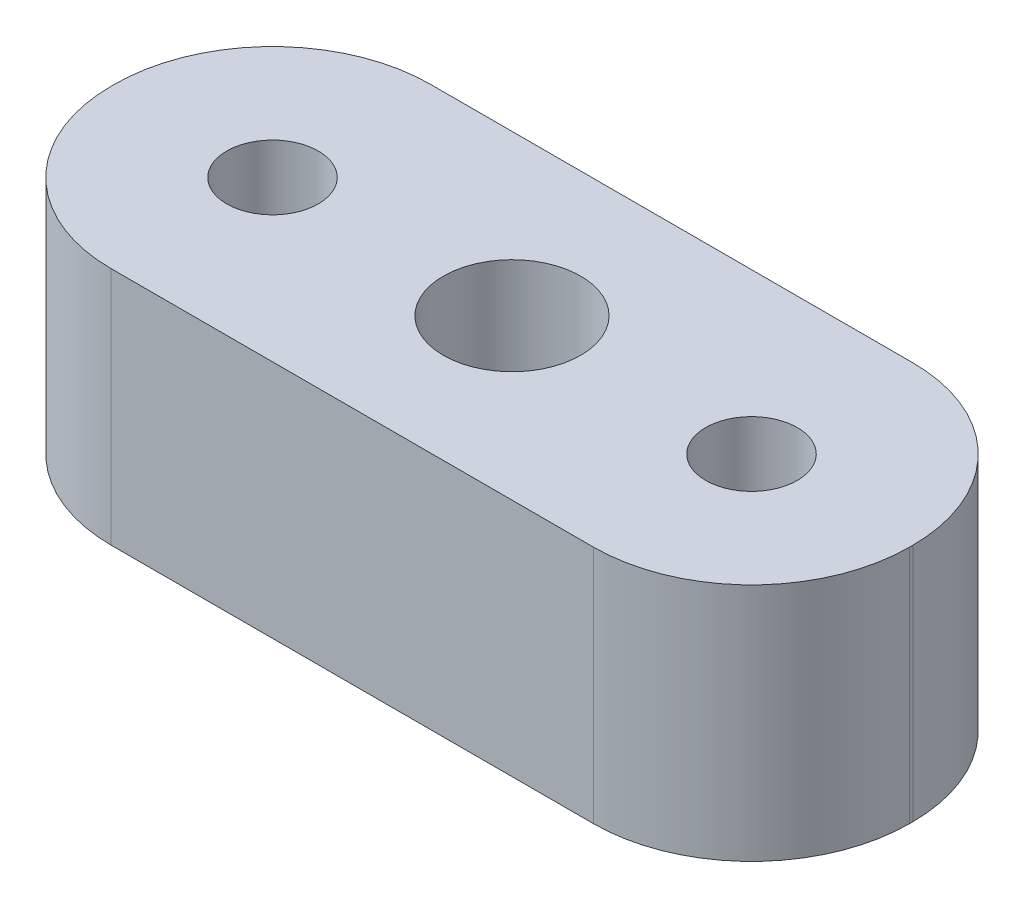
from build123d import *

# Parameters (mm, degrees)
SKETCH1_R           = 0.43
SKETCH1_R_2         = 0.287
BOSS_EXTRUDE1_DEPTH = 1.5


with BuildPart() as part:
    # Sketch1 → Boss-Extrude1 (new body)
    with BuildSketch(Plane(origin=(0, 0, 0), x_dir=(1, 0, 0), z_dir=(0, 1, 0))):
        with BuildLine():
            Line((-1.51, 1), (1.51, 1))
            ThreePointArc((1.51, 1), (2.210035713, 0.710035713), (2.5, 0.01))
            Line((2.5, 0.01), (2.5, -0.01))
            ThreePointArc((2.5, -0.01), (2.210035713, -0.710035713), (1.51, -1))
            Line((1.51, -1), (-1.51, -1))
            ThreePointArc((-1.51, -1), (-2.210035713, -0.710035713), (-2.5, -0.01))
            Line((-2.5, -0.01), (-2.5, 0.01))
            ThreePointArc((-2.5, 0.01), (-2.210035713, 0.710035713), (-1.51, 1))
        make_face()
        with Locations(Location((0, 0, 0), (0, 0, 270))):
            Circle(SKETCH1_R, mode=Mode.SUBTRACT)
        with Locations(Location((1.5, 0, 0), (0, 0, 270))):
            Circle(SKETCH1_R_2, mode=Mode.SUBTRACT)
        with Locations(Location((-1.5, 0, 0), (0, 0, 270))):
            Circle(SKETCH1_R_2, mode=Mode.SUBTRACT)
    extrude(amount=BOSS_EXTRUDE1_DEPTH)


solid = part.part
